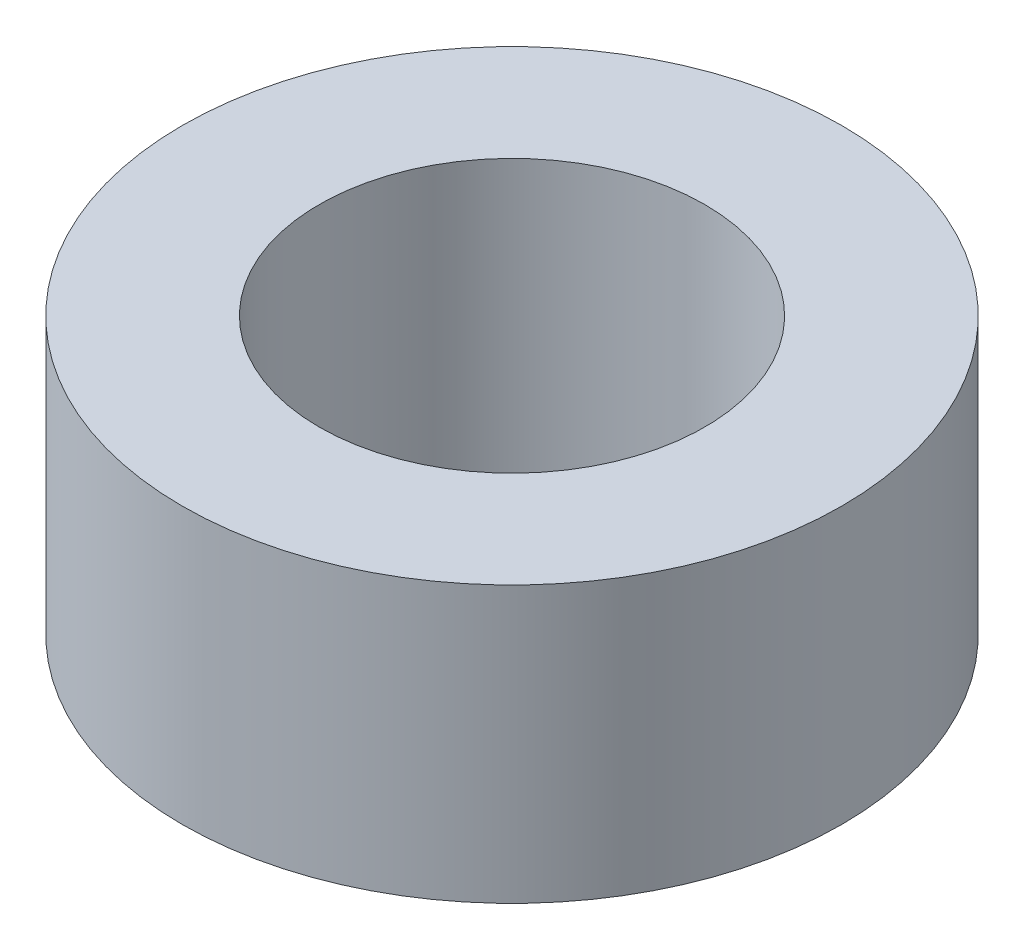
from build123d import *

# Parameters (mm, degrees)
SKETCH1_R           = 2.75
SKETCH1_R_2         = 1.608
BOSS_EXTRUDE1_DEPTH = 2.3


with BuildPart() as part:
    # Sketch1 → Boss-Extrude1 (new body)
    with BuildSketch(Plane(origin=(0, 0, 0), x_dir=(1, 0, 0), z_dir=(0, 1, 0))):
        with Locations(Location((0, 0, 0), (0, 0, 270))):
            Circle(SKETCH1_R)
        with Locations(Location((0, 0, 0), (0, 0, 270))):
            Circle(SKETCH1_R_2, mode=Mode.SUBTRACT)
    extrude(amount=BOSS_EXTRUDE1_DEPTH)


solid = part.part
